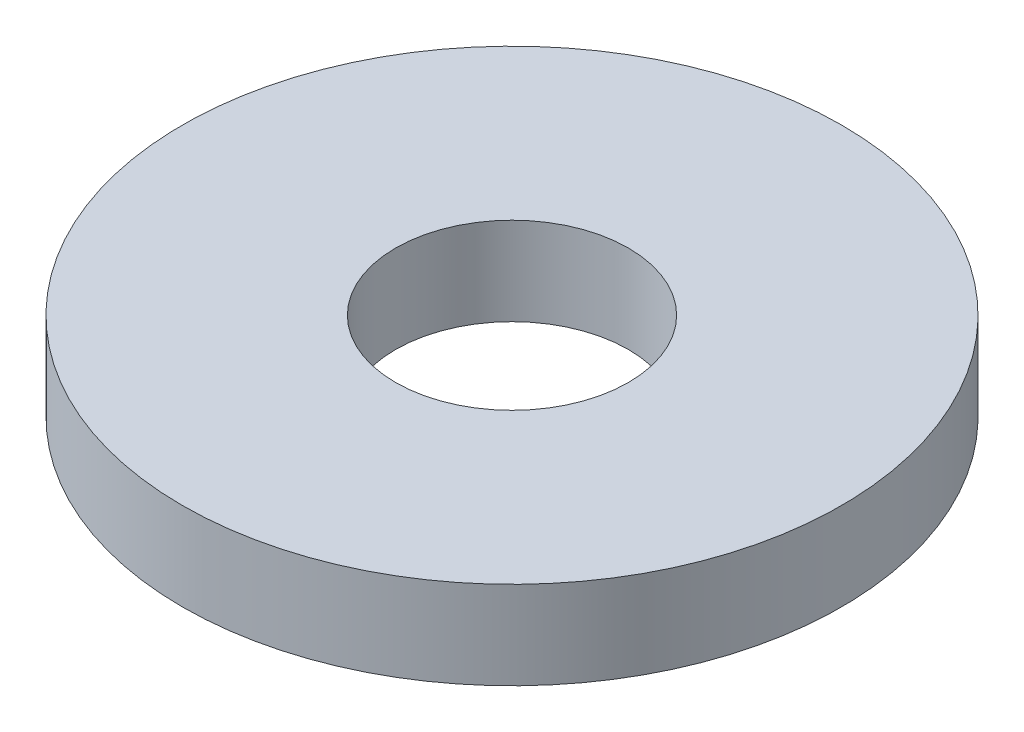
from build123d import *

# Parameters (mm, degrees)
SKETCH1_R           = 7.5
SKETCH1_R_2         = 2.65
BOSS_EXTRUDE1_DEPTH = 2


with BuildPart() as part:
    # Sketch1 → Boss-Extrude1 (new body)
    with BuildSketch(Plane(origin=(0, 0, 0), x_dir=(1, 0, 0), z_dir=(0, 1, 0))):
        with Locations(Location((0, 0, 0), (0, 0, 270))):
            Circle(SKETCH1_R)
        with Locations(Location((0, 0, 0), (0, 0, 270))):
            Circle(SKETCH1_R_2, mode=Mode.SUBTRACT)
    extrude(amount=BOSS_EXTRUDE1_DEPTH)


solid = part.part
